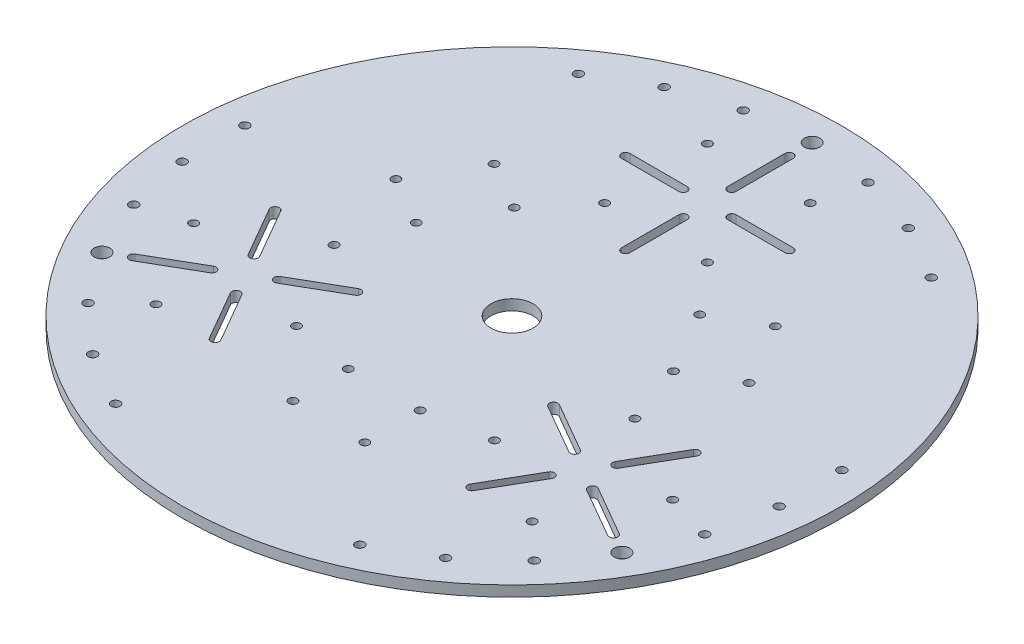
from build123d import *

# Parameters (mm, degrees)
SKETCH1_R           = 125
SKETCH1_R_2         = 8
SKETCH1_R_3         = 2.95
SKETCH1_R_4         = 1.675
SKETCH1_R_5         = 1.6
BOSS_EXTRUDE2_DEPTH = 4


with BuildPart() as part:
    # Sketch1 → Boss-Extrude2 (new body)
    with BuildSketch(Plane(origin=(0, 0, 0), x_dir=(1, 0, 0), z_dir=(0, 1, 0))):
        with Locations(Location((0, 0, 0), (0, 0, 270))):
            Circle(SKETCH1_R)
        with Locations(Location((0, 0, 0), (0, 0, 270))):
            Circle(SKETCH1_R_2, mode=Mode.SUBTRACT)
        with Locations(Location((0, 113.85, 0), (0, 0, 270))):
            Circle(SKETCH1_R_3, mode=Mode.SUBTRACT)
        with Locations(Location((98.596992221, -56.925, 0), (0, 0, 270))):
            Circle(SKETCH1_R_3, mode=Mode.SUBTRACT)
        with Locations(Location((-98.596992221, -56.925, 0), (0, 0, 270))):
            Circle(SKETCH1_R_3, mode=Mode.SUBTRACT)
        with Locations(Location((23.670746, 111.362104344, 0), (0, 0, 270))):
            Circle(SKETCH1_R_4, mode=Mode.SUBTRACT)
        with Locations(Location((46.306966814, 104.007150353, 0), (0, 0, 270))):
            Circle(SKETCH1_R_4, mode=Mode.SUBTRACT)
        with Locations(Location((66.919350973, 92.10658481, 0), (0, 0, 270))):
            Circle(SKETCH1_R_4, mode=Mode.SUBTRACT)
        with Locations(Location((113.226317788, 11.900565543, 0), (0, 0, 270))):
            Circle(SKETCH1_R_4, mode=Mode.SUBTRACT)
        with Locations(Location((113.226317788, -11.900565543, 0), (0, 0, 270))):
            Circle(SKETCH1_R_4, mode=Mode.SUBTRACT)
        with Locations(Location((108.27778438, -35.18158481, 0), (0, 0, 270))):
            Circle(SKETCH1_R_4, mode=Mode.SUBTRACT)
        with Locations(Location((84.607038381, -76.180519534, 0), (0, 0, 270))):
            Circle(SKETCH1_R_4, mode=Mode.SUBTRACT)
        with Locations(Location((66.919350974, -92.10658481, 0), (0, 0, 270))):
            Circle(SKETCH1_R_4, mode=Mode.SUBTRACT)
        with Locations(Location((46.306966814, -104.007150353, 0), (0, 0, 270))):
            Circle(SKETCH1_R_4, mode=Mode.SUBTRACT)
        with Locations(Location((-46.306966814, -104.007150353, 0), (0, 0, 270))):
            Circle(SKETCH1_R_4, mode=Mode.SUBTRACT)
        with Locations(Location((-66.919350973, -92.10658481, 0), (0, 0, 270))):
            Circle(SKETCH1_R_4, mode=Mode.SUBTRACT)
        with Locations(Location((-84.607038381, -76.180519534, 0), (0, 0, 270))):
            Circle(SKETCH1_R_4, mode=Mode.SUBTRACT)
        with Locations(Location((-108.27778438, -35.18158481, 0), (0, 0, 270))):
            Circle(SKETCH1_R_4, mode=Mode.SUBTRACT)
        with Locations(Location((-113.226317788, -11.900565543, 0), (0, 0, 270))):
            Circle(SKETCH1_R_4, mode=Mode.SUBTRACT)
        with Locations(Location((-113.226317788, 11.900565543, 0), (0, 0, 270))):
            Circle(SKETCH1_R_4, mode=Mode.SUBTRACT)
        with Locations(Location((-66.919350973, 92.10658481, 0), (0, 0, 270))):
            Circle(SKETCH1_R_4, mode=Mode.SUBTRACT)
        with Locations(Location((-46.306966814, 104.007150353, 0), (0, 0, 270))):
            Circle(SKETCH1_R_4, mode=Mode.SUBTRACT)
        with Locations(Location((-23.670746, 111.362104344, 0), (0, 0, 270))):
            Circle(SKETCH1_R_4, mode=Mode.SUBTRACT)
        with Locations(Location((-90.831628429, -29.925004626, 0), (0, 0, 270))):
            Circle(SKETCH1_R_5, mode=Mode.SUBTRACT)
        with Locations(Location((-57.056637682, -10.425004626, 0), (0, 0, 270))):
            Circle(SKETCH1_R_5, mode=Mode.SUBTRACT)
        with Locations(Location((-37.556637682, -44.199995374, 0), (0, 0, 270))):
            Circle(SKETCH1_R_5, mode=Mode.SUBTRACT)
        with Locations(Location((-71.331628429, -63.699995374, 0), (0, 0, 270))):
            Circle(SKETCH1_R_5, mode=Mode.SUBTRACT)
        with Locations(Location((19.5, 93.625, 0), (0, 0, 270))):
            Circle(SKETCH1_R_5, mode=Mode.SUBTRACT)
        with Locations(Location((19.5, 54.625, 0), (0, 0, 270))):
            Circle(SKETCH1_R_5, mode=Mode.SUBTRACT)
        with Locations(Location((-19.5, 54.625, 0), (0, 0, 270))):
            Circle(SKETCH1_R_5, mode=Mode.SUBTRACT)
        with Locations(Location((-19.5, 93.625, 0), (0, 0, 270))):
            Circle(SKETCH1_R_5, mode=Mode.SUBTRACT)
        with Locations(Location((71.331628429, -63.699995374, 0), (0, 0, 270))):
            Circle(SKETCH1_R_5, mode=Mode.SUBTRACT)
        with Locations(Location((37.556637682, -44.199995374, 0), (0, 0, 270))):
            Circle(SKETCH1_R_5, mode=Mode.SUBTRACT)
        with Locations(Location((57.056637682, -10.425004626, 0), (0, 0, 270))):
            Circle(SKETCH1_R_5, mode=Mode.SUBTRACT)
        with Locations(Location((90.831628429, -29.925004626, 0), (0, 0, 270))):
            Circle(SKETCH1_R_5, mode=Mode.SUBTRACT)
        with Locations(Location((-13.625, -48.465, 0), (0, 0, 270))):
            Circle(SKETCH1_R_5, mode=Mode.SUBTRACT)
        with Locations(Location((13.625, -48.465, 0), (0, 0, 270))):
            Circle(SKETCH1_R_5, mode=Mode.SUBTRACT)
        with Locations(Location((13.625, -69.465, 0), (0, 0, 270))):
            Circle(SKETCH1_R_5, mode=Mode.SUBTRACT)
        with Locations(Location((-13.625, -69.465, 0), (0, 0, 270))):
            Circle(SKETCH1_R_5, mode=Mode.SUBTRACT)
        with Locations(Location((-35.159421194, 36.032096127, 0), (0, 0, 270))):
            Circle(SKETCH1_R_5, mode=Mode.SUBTRACT)
        with Locations(Location((-48.784421194, 12.432903873, 0), (0, 0, 270))):
            Circle(SKETCH1_R_5, mode=Mode.SUBTRACT)
        with Locations(Location((-66.970954674, 22.932903873, 0), (0, 0, 270))):
            Circle(SKETCH1_R_5, mode=Mode.SUBTRACT)
        with Locations(Location((-53.345954674, 46.532096127, 0), (0, 0, 270))):
            Circle(SKETCH1_R_5, mode=Mode.SUBTRACT)
        with Locations(Location((48.784421194, 12.432903873, 0), (0, 0, 270))):
            Circle(SKETCH1_R_5, mode=Mode.SUBTRACT)
        with Locations(Location((35.159421194, 36.032096127, 0), (0, 0, 270))):
            Circle(SKETCH1_R_5, mode=Mode.SUBTRACT)
        with Locations(Location((53.345954674, 46.532096127, 0), (0, 0, 270))):
            Circle(SKETCH1_R_5, mode=Mode.SUBTRACT)
        with Locations(Location((66.970954674, 22.932903873, 0), (0, 0, 270))):
            Circle(SKETCH1_R_5, mode=Mode.SUBTRACT)
        with BuildLine():
            Line((-71.383217405, -43.060640646), (-90.262571208, -53.960640646))
            ThreePointArc((-90.262571208, -53.960640646), (-92.448211854, -53.375), (-91.862571208, -51.189359354))
            Line((-91.862571208, -51.189359354), (-72.983217405, -40.289359354))
            ThreePointArc((-72.983217405, -40.289359354), (-70.797576759, -40.875), (-71.383217405, -43.060640646))
        make_face(mode=Mode.SUBTRACT)
        with BuildLine():
            Line((-36.525694903, -22.935640646), (-55.405048706, -33.835640646))
            ThreePointArc((-55.405048706, -33.835640646), (-57.590689352, -33.25), (-57.005048706, -31.064359354))
            Line((-57.005048706, -31.064359354), (-38.125694903, -20.164359354))
            ThreePointArc((-38.125694903, -20.164359354), (-35.940054257, -20.75), (-36.525694903, -22.935640646))
        make_face(mode=Mode.SUBTRACT)
        with BuildLine():
            Line((-70.192273702, -29.87341565), (-81.092273702, -10.994061848))
            ThreePointArc((-81.092273702, -10.994061848), (-80.506633056, -8.808421202), (-78.320992409, -9.394061848))
            Line((-78.320992409, -9.394061848), (-67.420992409, -28.27341565))
            ThreePointArc((-67.420992409, -28.27341565), (-68.006633056, -30.459056296), (-70.192273702, -29.87341565))
        make_face(mode=Mode.SUBTRACT)
        with BuildLine():
            Line((-58.195992409, -44.25158435), (-47.295992409, -63.130938152))
            ThreePointArc((-47.295992409, -63.130938152), (-47.881633056, -65.316578798), (-50.067273702, -64.730938152))
            Line((-50.067273702, -64.730938152), (-60.967273702, -45.85158435))
            ThreePointArc((-60.967273702, -45.85158435), (-60.381633056, -43.665943704), (-58.195992409, -44.25158435))
        make_face(mode=Mode.SUBTRACT)
        with BuildLine():
            Line((-1.6, 83.35), (-1.6, 105.15))
            ThreePointArc((-1.6, 105.15), (0, 106.75), (1.6, 105.15))
            Line((1.6, 105.15), (1.6, 83.35))
            ThreePointArc((1.6, 83.35), (0, 81.75), (-1.6, 83.35))
        make_face(mode=Mode.SUBTRACT)
        with BuildLine():
            Line((-1.6, 43.1), (-1.6, 64.9))
            ThreePointArc((-1.6, 64.9), (0, 66.5), (1.6, 64.9))
            Line((1.6, 64.9), (1.6, 43.1))
            ThreePointArc((1.6, 43.1), (0, 41.5), (-1.6, 43.1))
        make_face(mode=Mode.SUBTRACT)
        with BuildLine():
            Line((9.225, 75.725), (31.025, 75.725))
            ThreePointArc((31.025, 75.725), (32.625, 74.125), (31.025, 72.525))
            Line((31.025, 72.525), (9.225, 72.525))
            ThreePointArc((9.225, 72.525), (7.625, 74.125), (9.225, 75.725))
        make_face(mode=Mode.SUBTRACT)
        with BuildLine():
            Line((-9.225, 72.525), (-31.025, 72.525))
            ThreePointArc((-31.025, 72.525), (-32.625, 74.125), (-31.025, 75.725))
            Line((-31.025, 75.725), (-9.225, 75.725))
            ThreePointArc((-9.225, 75.725), (-7.625, 74.125), (-9.225, 72.525))
        make_face(mode=Mode.SUBTRACT)
        with BuildLine():
            Line((72.983217405, -40.289359354), (91.862571208, -51.189359354))
            ThreePointArc((91.862571208, -51.189359354), (92.448211854, -53.375), (90.262571208, -53.960640646))
            Line((90.262571208, -53.960640646), (71.383217405, -43.060640646))
            ThreePointArc((71.383217405, -43.060640646), (70.797576759, -40.875), (72.983217405, -40.289359354))
        make_face(mode=Mode.SUBTRACT)
        with BuildLine():
            Line((38.125694903, -20.164359354), (57.005048706, -31.064359354))
            ThreePointArc((57.005048706, -31.064359354), (57.590689352, -33.25), (55.405048706, -33.835640646))
            Line((55.405048706, -33.835640646), (36.525694903, -22.935640646))
            ThreePointArc((36.525694903, -22.935640646), (35.940054257, -20.75), (38.125694903, -20.164359354))
        make_face(mode=Mode.SUBTRACT)
        with BuildLine():
            Line((60.967273702, -45.85158435), (50.067273702, -64.730938152))
            ThreePointArc((50.067273702, -64.730938152), (47.881633056, -65.316578798), (47.295992409, -63.130938152))
            Line((47.295992409, -63.130938152), (58.195992409, -44.25158435))
            ThreePointArc((58.195992409, -44.25158435), (60.381633056, -43.665943704), (60.967273702, -45.85158435))
        make_face(mode=Mode.SUBTRACT)
        with BuildLine():
            Line((67.420992409, -28.27341565), (78.320992409, -9.394061848))
            ThreePointArc((78.320992409, -9.394061848), (80.506633056, -8.808421202), (81.092273702, -10.994061848))
            Line((81.092273702, -10.994061848), (70.192273702, -29.87341565))
            ThreePointArc((70.192273702, -29.87341565), (68.006633056, -30.459056296), (67.420992409, -28.27341565))
        make_face(mode=Mode.SUBTRACT)
    extrude(amount=BOSS_EXTRUDE2_DEPTH)


solid = part.part
